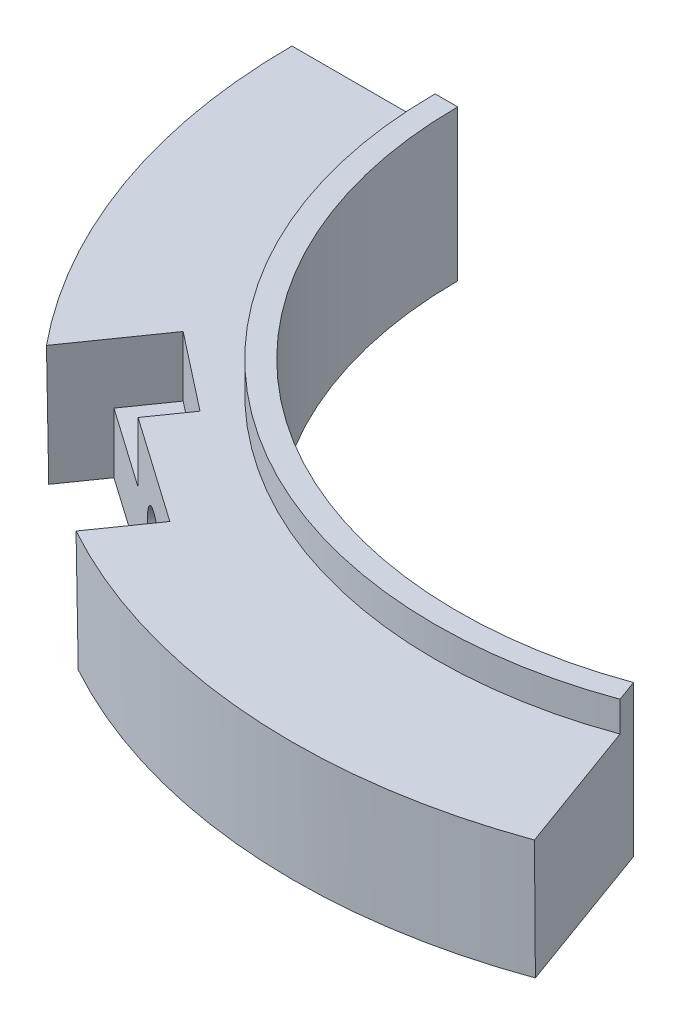
from build123d import *

# Parameters (mm, degrees)
REVOLVE1_ANGLE                                      = 110
BOSS_EXTRUDE2_START                                 = 2
BOSS_EXTRUDE2_DEPTH                                 = 2
CUT_EXTRUDE3_DEPTH                                  = 4.3
CUT_EXTRUDE3_DEPTH_BACK                             = 4.3
SKETCH6_W                                           = 4.978949903
SKETCH6_H                                           = 35.147852634
CSK_FOR_M3_COUNTERSUNK_FLAT_HEAD_SCREW1_D           = 3.4
CSK_FOR_M3_COUNTERSUNK_FLAT_HEAD_SCREW1_CSINK_D     = 6.3
CSK_FOR_M3_COUNTERSUNK_FLAT_HEAD_SCREW1_CSINK_ANGLE = 90
CUT_EXTRUDE4_DEPTH                                  = 58.131427582
CUT_EXTRUDE5_DEPTH                                  = 4


with BuildPart() as part:
    # Sketch1 → Revolve1 (revolve)
    with BuildSketch(Plane.XY):
        Polygon((-29, 0), (-29, 8), (-40, 8), (-39.896417966, 0.000670605), align=None)
    revolve(axis=Axis((0, 0, 0), (0, 1, 0)), revolution_arc=REVOLVE1_ANGLE)

    # Sketch2 → Boss-Extrude2 (add)
    with BuildSketch(Plane(origin=(0, 8, 0), x_dir=(1, 0, 0), z_dir=(0, 1, 0)).offset(BOSS_EXTRUDE2_START)):
        with BuildLine():
            Line((-29, 0), (-30.5, 0))
            ThreePointArc((-30.5, 0), (-17.494081309, -24.984137351), (10.431614371, -28.660624934))
            Line((10.431614371, -28.660624934), (9.918584156, -27.251086003))
            ThreePointArc((9.918584156, -27.251086003), (-16.633716654, -23.755409284), (-29, 0))
        make_face()
    extrude(amount=-BOSS_EXTRUDE2_DEPTH)

    # Sketch6 → Cut-Extrude3 (cut, two sides: drawn at the far end of the back side and taken through both)
    with BuildSketch(Plane(origin=(0, 0, 0), x_dir=(0.5735764363510444, 0, -0.819152044288993), z_dir=(0.819152044288993, 0, 0.5735764363510444)).offset(-CUT_EXTRUDE3_DEPTH_BACK)):
        with Locations((-37.788406982, 11.886060953)):
            Rectangle(SKETCH6_W, SKETCH6_H)
    extrude(amount=CUT_EXTRUDE3_DEPTH + CUT_EXTRUDE3_DEPTH_BACK, mode=Mode.SUBTRACT)

    # CSK for M3 Countersunk Flat Head Screw1 (through all)
    with Locations(Plane(origin=(-16.693228701, 3.799474552, 23.713627212), x_dir=(-0.817711283166, 0, -0.575628575891), z_dir=(0.575628575891, 0, -0.817711283166))):
        with Locations((0, 0)):
            CounterSinkHole(CSK_FOR_M3_COUNTERSUNK_FLAT_HEAD_SCREW1_D / 2, CSK_FOR_M3_COUNTERSUNK_FLAT_HEAD_SCREW1_CSINK_D / 2, counter_sink_angle=CSK_FOR_M3_COUNTERSUNK_FLAT_HEAD_SCREW1_CSINK_ANGLE)

    # Sketch13 → Cut-Extrude4 (cut, through all)
    with BuildSketch(Plane(origin=(0, 8, 0), x_dir=(1, 0, 0), z_dir=(0, 1, 0))):
        Polygon((-23.768989432, -26.448813658), (-29.09347772, -22.720566822), (-32.344693082, -27.363783561), (-27.020204794, -31.092030397), align=None)
    extrude(amount=-CUT_EXTRUDE4_DEPTH, mode=Mode.SUBTRACT)

    # Sketch14 → Cut-Extrude5 (cut)
    with BuildSketch(Plane(origin=(0, 8, 0), x_dir=(1, 0, 0), z_dir=(0, 1, 0))):
        Polygon((-29.09347772, -22.720566822), (-23.756197421, -26.457770721), (-22.0628619, -24.039436971), (-27.202235941, -20.019593646), align=None)
    extrude(amount=-CUT_EXTRUDE5_DEPTH, mode=Mode.SUBTRACT)


solid = part.part
